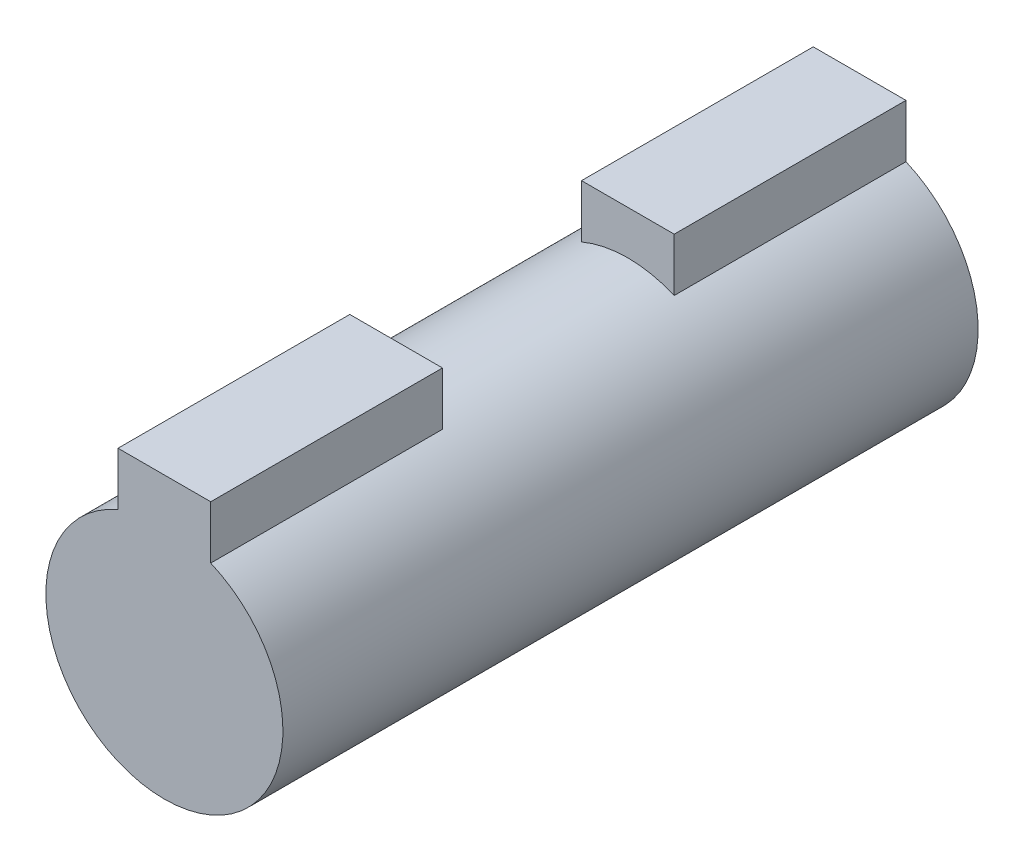
from build123d import *

# Parameters (mm, degrees)
BOSS_EXTRUDE1_DEPTH = 30
CUT_EXTRUDE1_START  = -20
SKETCH2_R           = 7.799957174
SKETCH2_R_2         = 5.1145
CUT_EXTRUDE1_DEPTH  = 10


with BuildPart() as part:
    # Sketch1 → Boss-Extrude1 (new body)
    with BuildSketch(Plane.XY):
        with BuildLine():
            Line((-2, 7), (2, 7))
            Line((2, 7), (2, 4.707240195))
            ThreePointArc((2, 4.707240195), (0, -5.1145), (-2, 4.707240195))
            Line((-2, 4.707240195), (-2, 7))
        make_face()
    extrude(amount=BOSS_EXTRUDE1_DEPTH)

    # Sketch2 → Cut-Extrude1 (cut)
    with BuildSketch(Plane.XY.offset(30).offset(CUT_EXTRUDE1_START)):
        Circle(SKETCH2_R)
        with Locations(Location((0, 0, 0), (0, 0, 113.01954222))):
            Circle(SKETCH2_R_2, mode=Mode.SUBTRACT)
    extrude(amount=CUT_EXTRUDE1_DEPTH, mode=Mode.SUBTRACT)


solid = part.part
